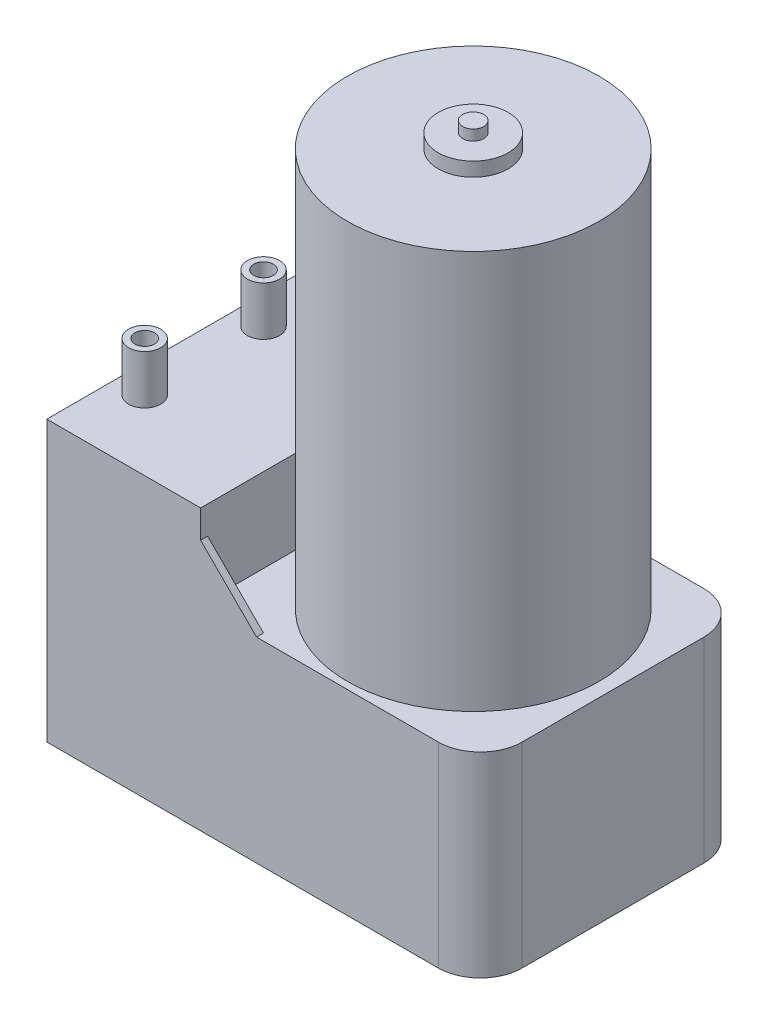
from build123d import *

# Parameters (mm, degrees)
ESQUISSE1_W             = 62
ESQUISSE1_H             = 38
BOSS_EXTRU_1_DEPTH      = 28
CONG_1_R                = 6
ESQUISSE3_W             = 22
ESQUISSE3_H             = 12
BOSS_EXTRU_2_DEPTH      = 38
ESQUISSE4_R             = 2.3
BOSS_EXTRU_3_DEPTH      = 7
ESQUISSE5_R             = 1.4
ENL_V_MAT_EXTRU_1_DEPTH = 40
ESQUISSE6_R             = 18
BOSS_EXTRU_4_DEPTH      = 57
ESQUISSE7_R             = 5
BOSS_EXTRU_5_DEPTH      = 2
BOSS_EXTRU_6_DEPTH      = 1
BOSS_EXTRU_7_DEPTH      = 1
ESQUISSE10_R            = 1.5
BOSS_EXTRU_8_DEPTH      = 1.5


with BuildPart() as part:
    # Esquisse1 → Boss.-Extru.1 (new body)
    with BuildSketch(Plane(origin=(0, 0, 0), x_dir=(1, 0, 0), z_dir=(0, 1, 0))):
        with Locations((31, 19)):
            Rectangle(ESQUISSE1_W, ESQUISSE1_H)
    extrude(amount=BOSS_EXTRU_1_DEPTH)

    # Congé1
    cong_1_edges = [part.edges().sort_by_distance(p)[0] for p in [
        (62, 14, -38),
        (62, 14, 0),
    ]]
    fillet(cong_1_edges, radius=CONG_1_R)

    # Esquisse3 → Boss.-Extru.2 (add)
    with BuildSketch(Plane.XY):
        with Locations((11, 34)):
            Rectangle(ESQUISSE3_W, ESQUISSE3_H)
    extrude(amount=-BOSS_EXTRU_2_DEPTH)

    # Esquisse4 → Boss.-Extru.3 (add)
    with BuildSketch(Plane(origin=(0, 40, 0), x_dir=(1, 0, 0), z_dir=(0, 1, 0))):
        with Locations((4, 10)):
            Circle(ESQUISSE4_R)
        with Locations((4, 27)):
            Circle(ESQUISSE4_R)
    extrude(amount=BOSS_EXTRU_3_DEPTH)

    # Esquisse5 → Enlèv. mat.-Extru.1 (cut)
    with BuildSketch(Plane(origin=(0, 47, 0), x_dir=(1, 0, 0), z_dir=(0, 1, 0))):
        with Locations((4, 10)):
            Circle(ESQUISSE5_R)
        with Locations((4, 27)):
            Circle(ESQUISSE5_R)
    extrude(amount=-ENL_V_MAT_EXTRU_1_DEPTH, mode=Mode.SUBTRACT)

    # Esquisse6 → Boss.-Extru.4 (add)
    with BuildSketch(Plane(origin=(0, 28, 0), x_dir=(1, 0, 0), z_dir=(0, 1, 0))):
        with Locations((42, 19)):
            Circle(ESQUISSE6_R)
    extrude(amount=BOSS_EXTRU_4_DEPTH)

    # Esquisse7 → Boss.-Extru.5 (add)
    with BuildSketch(Plane(origin=(0, 85, 0), x_dir=(1, 0, 0), z_dir=(0, 1, 0))):
        with Locations((42, 19)):
            Circle(ESQUISSE7_R)
    extrude(amount=BOSS_EXTRU_5_DEPTH)

    # Esquisse8 → Boss.-Extru.6 (add)
    with BuildSketch(Plane.XY):
        Polygon((22, 28), (30, 28), (22, 36), align=None)
    extrude(amount=-BOSS_EXTRU_6_DEPTH)

    # Esquisse10 → Boss.-Extru.8 (add)
    with BuildSketch(Plane(origin=(0, 87, 0), x_dir=(1, 0, 0), z_dir=(0, 1, 0))):
        with Locations((42, 19)):
            Circle(ESQUISSE10_R)
    extrude(amount=BOSS_EXTRU_8_DEPTH)


with BuildPart() as body_2:
    # Esquisse9 → Boss.-Extru.7 (new body)
    with BuildSketch(Plane(origin=(0, 0, -38), x_dir=(-1, 0, 0), z_dir=(0, 0, -1))):
        Polygon((-22, 28), (-22, 36), (-30, 28), align=None)
    extrude(amount=-BOSS_EXTRU_7_DEPTH)


solid = Compound([part.part, body_2.part])
